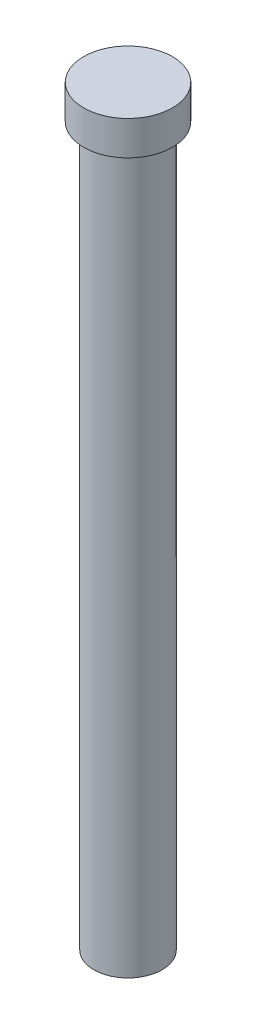
from build123d import *


with BuildPart() as part:
    # Sketch1 → Revolve1 (revolve)
    with BuildSketch(Plane.XY, mode=Mode.PRIVATE) as revolve1_sk:
        Polygon((0, 0), (6.5, 0), (6.5, -5), (5, -5), (5, -110), (0, -110), align=None)
    revolve(revolve1_sk.sketch.rotate(Axis((0, -115, 0), (0, 1, 0)), 90), axis=Axis((0, -115, 0), (0, 1, 0)))


solid = part.part
